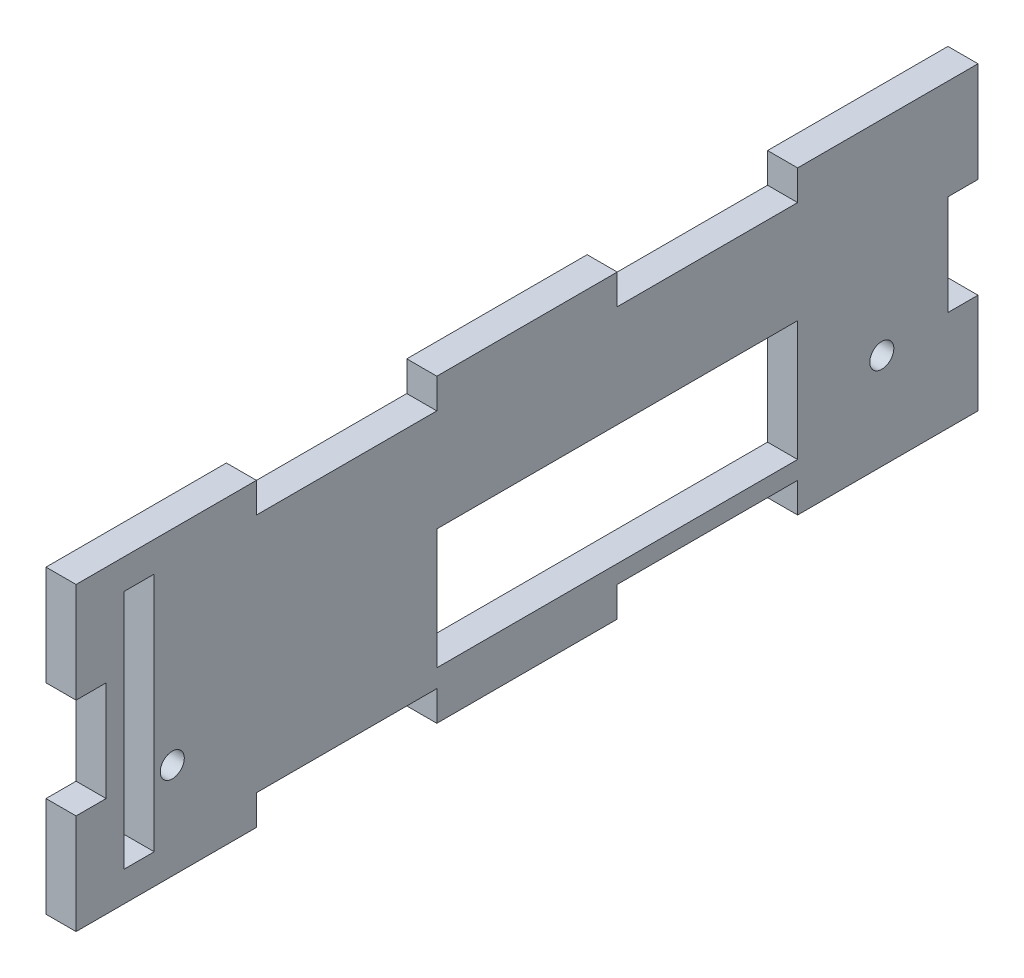
from build123d import *

# Parameters (mm, degrees)
CROQUIS1_R              = 2
SALIENTE_EXTRUIR1_DEPTH = 5
CROQUIS2_W              = 60
CROQUIS2_H              = 20
CORTAR_EXTRUIR1_DEPTH   = 10
CROQUIS3_W              = 5
CROQUIS3_H              = 40
CORTAR_EXTRUIR2_DEPTH   = 10


with BuildPart() as part:
    # Croquis1 → Saliente-Extruir1 (new body)
    with BuildSketch(Plane(origin=(0, 0, 0), x_dir=(0, 0, -1), z_dir=(1, 0, 0))):
        Polygon((0, 33.333333333), (5, 33.333333333), (5, 16.666666667), (0, 16.666666667), (0, 0), (30, 0), (30, 5), (60, 5), (60, 0), (90, 0), (90, 5), (120, 5), (120, 0), (150, 0), (150, 16.666666667), (145, 16.666666667), (145, 33.333333333), (150, 33.333333333), (150, 50), (120, 50), (120, 45), (90, 45), (90, 50), (60, 50), (60, 45), (30, 45), (30, 50), (0, 50), align=None)
        with Locations((16, 16)):
            Circle(CROQUIS1_R, mode=Mode.SUBTRACT)
        with Locations(Location((134, 16, 0), (0, 0, 180))):
            Circle(CROQUIS1_R, mode=Mode.SUBTRACT)
    extrude(amount=SALIENTE_EXTRUIR1_DEPTH)

    # Croquis2 → Cortar-Extruir1 (cut)
    with BuildSketch(Plane(origin=(5, 0, 0), x_dir=(0, 0, -1), z_dir=(1, 0, 0))):
        with Locations((90, 18)):
            Rectangle(CROQUIS2_W, CROQUIS2_H)
    extrude(amount=-CORTAR_EXTRUIR1_DEPTH, mode=Mode.SUBTRACT)

    # Croquis3 → Cortar-Extruir2 (cut)
    with BuildSketch(Plane(origin=(5, 0, 0), x_dir=(0, 0, -1), z_dir=(1, 0, 0))):
        with Locations((10.5, 25)):
            Rectangle(CROQUIS3_W, CROQUIS3_H)
    extrude(amount=-CORTAR_EXTRUIR2_DEPTH, mode=Mode.SUBTRACT)


solid = part.part
